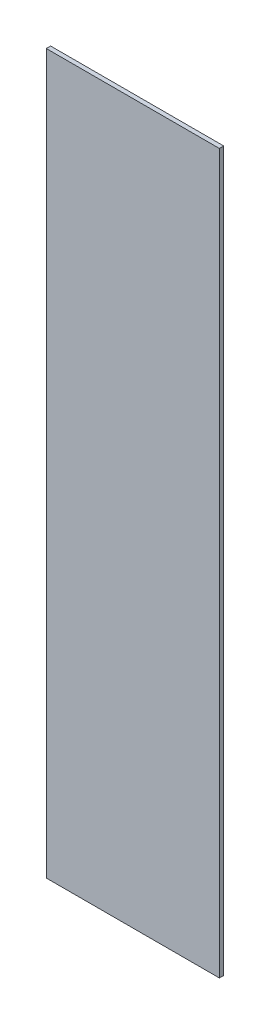
from build123d import *

# Parameters (mm, degrees)
SKETCH_1_W      = 20
SKETCH_1_H      = 83
EXTRUDE_1_DEPTH = 0.5


with BuildPart() as part:
    # 草图1 → 凸台-拉伸1 (new body)
    with BuildSketch(Plane.XY):
        Rectangle(SKETCH_1_W, SKETCH_1_H)
    extrude(amount=EXTRUDE_1_DEPTH)


solid = part.part
